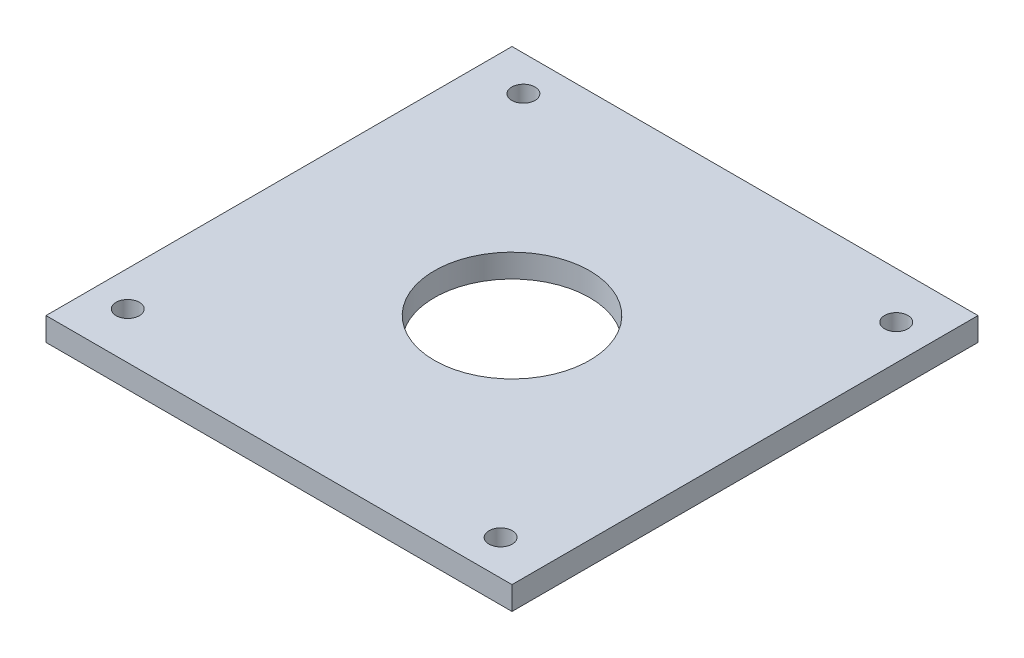
from build123d import *

# Parameters (mm, degrees)
SKETCH_1_W      = 60
SKETCH_1_H      = 60
SKETCH_1_R      = 1.5
SKETCH_1_R_2    = 10
EXTRUDE_1_DEPTH = 3


with BuildPart() as part:
    # 草图1 → 凸台-拉伸1 (new body)
    with BuildSketch(Plane(origin=(0, 0, 0), x_dir=(1, 0, 0), z_dir=(0, 1, 0))):
        Rectangle(SKETCH_1_W, SKETCH_1_H)
        with Locations(Location((25.470855093, 24.004906599, 0), (0, 0, 270))):
            Circle(SKETCH_1_R, mode=Mode.SUBTRACT)
        with Locations(Location((0, 0, 0), (0, 0, 270))):
            Circle(SKETCH_1_R_2, mode=Mode.SUBTRACT)
        with Locations(Location((24.004906599, -25.470855093, 0), (0, 0, 270))):
            Circle(SKETCH_1_R, mode=Mode.SUBTRACT)
        with Locations(Location((-25.470855093, -24.004906599, 0), (0, 0, 270))):
            Circle(SKETCH_1_R, mode=Mode.SUBTRACT)
        with Locations(Location((-24.004906599, 25.470855093, 0), (0, 0, 270))):
            Circle(SKETCH_1_R, mode=Mode.SUBTRACT)
    extrude(amount=EXTRUDE_1_DEPTH)


solid = part.part
